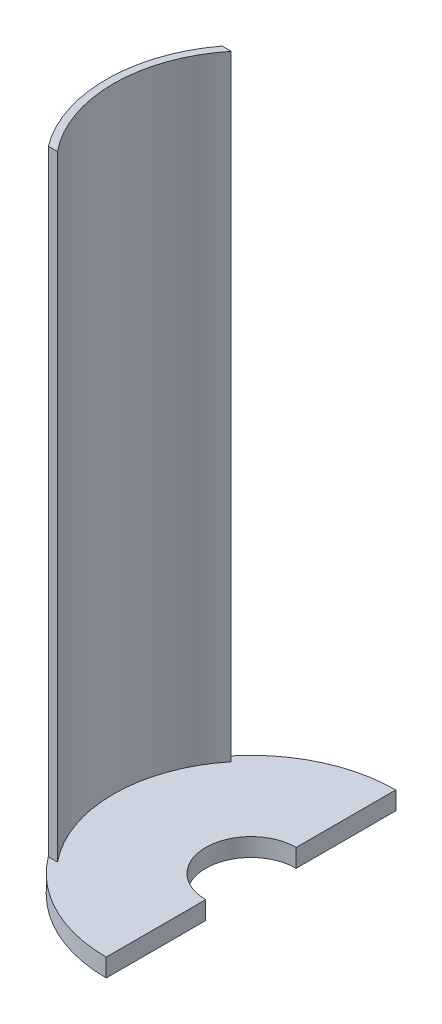
from build123d import *

# Parameters (mm, degrees)
BOSS_EXTRUDE1_DEPTH = 5
BOSS_EXTRUDE2_DEPTH = 170


with BuildPart() as part:
    # Sketch1 → Boss-Extrude1 (new body)
    with BuildSketch(Plane(origin=(0, 0, 0), x_dir=(1, 0, 0), z_dir=(0, 1, 0))):
        with BuildLine():
            Line((0, 40), (0, 12.5))
            ThreePointArc((0, 12.5), (-12.5, 0), (0, -12.5))
            Line((0, -12.5), (0, -40))
            ThreePointArc((0, -40), (-40, 0), (0, 40))
        make_face()
    extrude(amount=BOSS_EXTRUDE1_DEPTH)

    # Sketch2 → Boss-Extrude2 (add)
    with BuildSketch(Plane(origin=(0, 5, 0), x_dir=(1, 0, 0), z_dir=(0, 1, 0))):
        with BuildLine():
            ThreePointArc((-29.461839725, -24), (-38, 0), (-29.461839725, 24))
            Line((-29.461839725, 24), (-32, 24))
            ThreePointArc((-32, 24), (-40, 0), (-32, -24))
            Line((-32, -24), (-29.461839725, -24))
        make_face()
    extrude(amount=BOSS_EXTRUDE2_DEPTH)


solid = part.part
